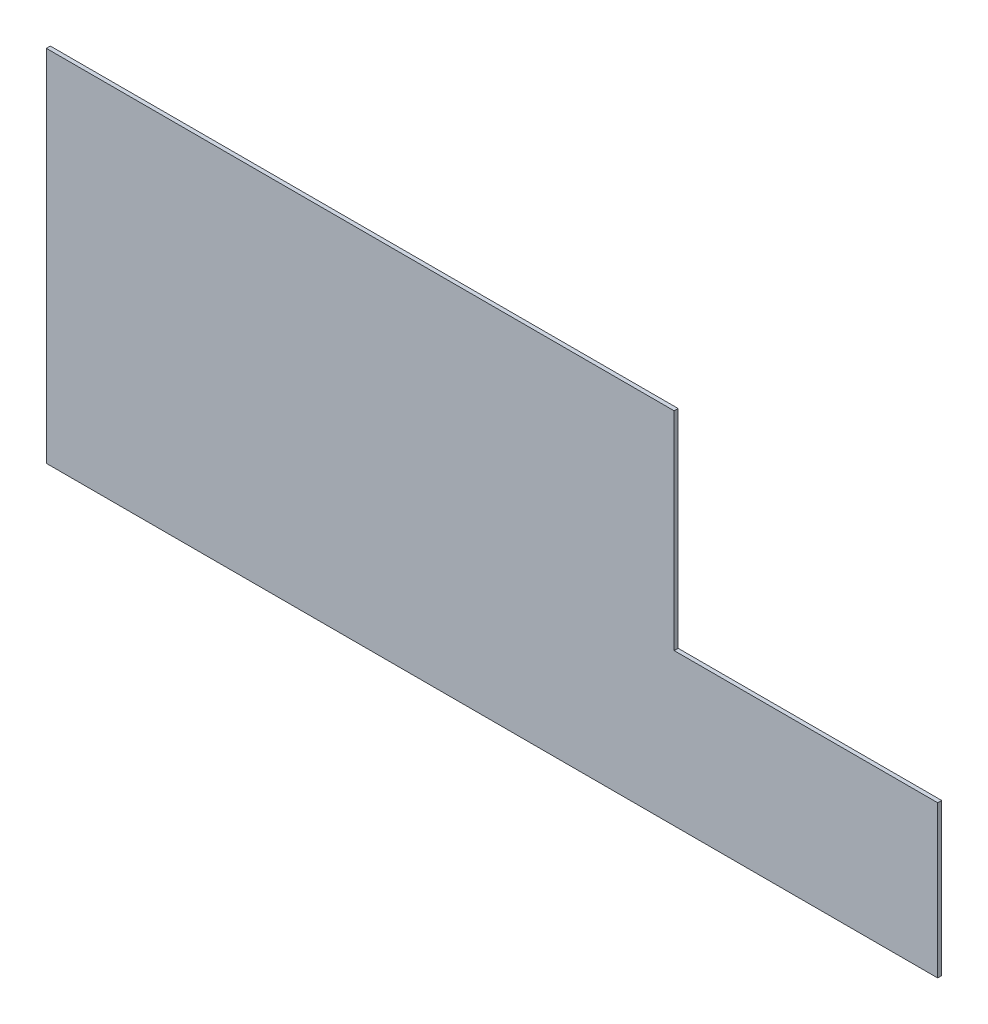
from build123d import *

# Parameters (mm, degrees)
SCHIZZO1_W                   = 558
SCHIZZO1_H                   = 225
ESTRUSIONE_ESTRUSIONE1_DEPTH = 2.5
SCHIZZO2_W                   = 165
SCHIZZO2_H                   = 130
TAGLIO_ESTRUSIONE1_DEPTH     = 10


with BuildPart() as part:
    # Schizzo1 → Estrusione-Estrusione1 (new body)
    with BuildSketch(Plane.XY):
        Rectangle(SCHIZZO1_W, SCHIZZO1_H)
    extrude(amount=ESTRUSIONE_ESTRUSIONE1_DEPTH)

    # Schizzo2 → Taglio-Estrusione1 (cut)
    with BuildSketch(Plane(origin=(0, 0, 0), x_dir=(-1, 0, 0), z_dir=(0, 0, -1))):
        with Locations((-196.5, 47.5)):
            Rectangle(SCHIZZO2_W, SCHIZZO2_H)
    extrude(amount=-TAGLIO_ESTRUSIONE1_DEPTH, mode=Mode.SUBTRACT)


solid = part.part
